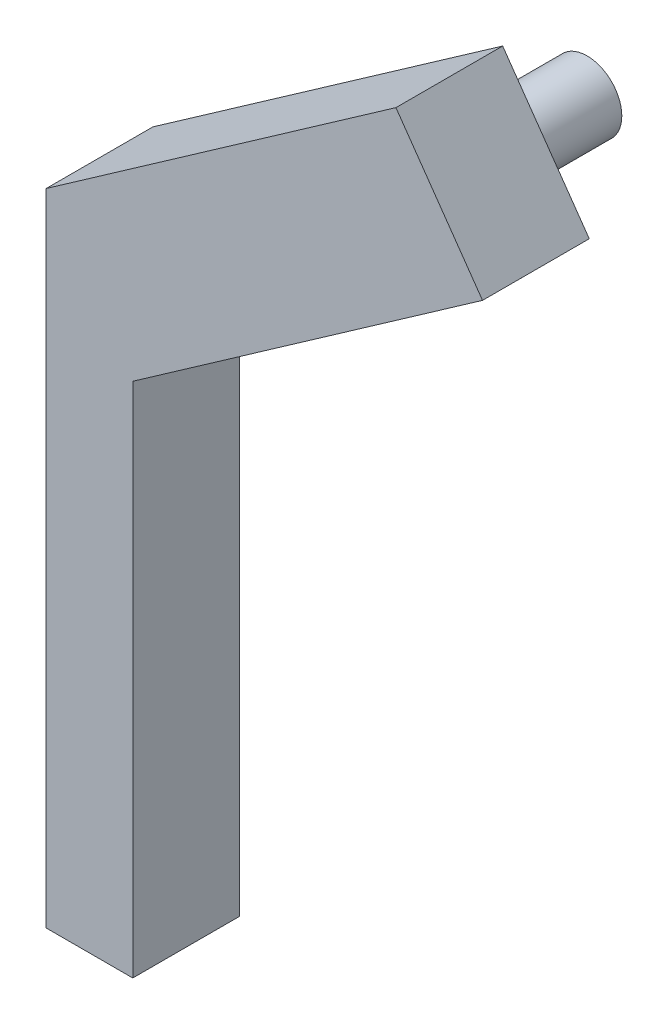
from build123d import *

# Parameters (mm, degrees)
BOSS_EXTRUDE1_DEPTH = 10
SKETCH3_R           = 3.25
BOSS_EXTRUDE3_DEPTH = 10


with BuildPart() as part:
    # Sketch1 → Boss-Extrude1 (new body)
    with BuildSketch(Plane.XY):
        Polygon((57.505122166, 3.914590247), (24.739040394, -19.028467207), (24.739040394, -79.028467207), (32.850636148, -79.028467207), (32.850636148, -30.613026513), (65.616717919, -7.669969059), align=None)
    extrude(amount=BOSS_EXTRUDE1_DEPTH)

    # Sketch3 → Boss-Extrude3 (add)
    with BuildSketch(Plane(origin=(0, 0, 0), x_dir=(-1, 0, 0), z_dir=(0, 0, -1))):
        with Locations(Location((-55.41727971, -6.179512679, 0), (0, 0, 180))):
            Circle(SKETCH3_R)
        with Locations(Location((-28.794838271, -24.82074686, 0), (0, 0, 180))):
            Circle(SKETCH3_R)
    extrude(amount=BOSS_EXTRUDE3_DEPTH)


solid = part.part
